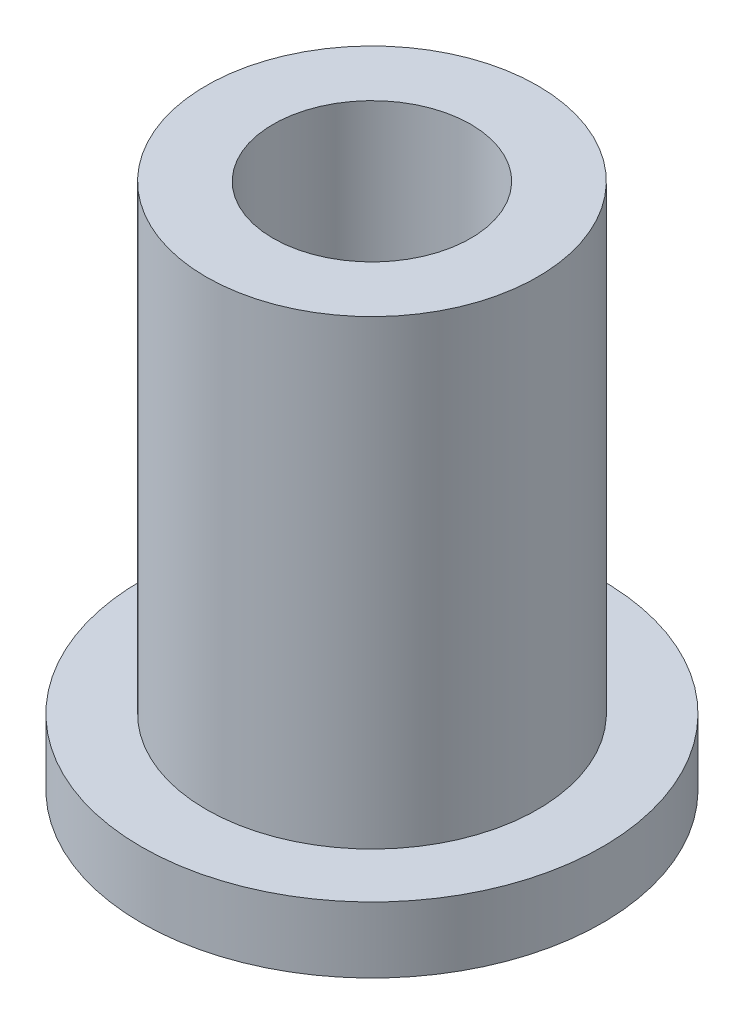
from build123d import *

# Parameters (mm, degrees)
SKETCH1_R           = 5.55625
BOSS_EXTRUDE1_DEPTH = 1.5875
SKETCH2_R           = 3.99415
BOSS_EXTRUDE2_DEPTH = 11.1125
SKETCH3_R           = 2.38125
CUT_EXTRUDE1_DEPTH  = 12.7


with BuildPart() as part:
    # Sketch1 → Boss-Extrude1 (new body)
    with BuildSketch(Plane(origin=(0, 0, 0), x_dir=(1, 0, 0), z_dir=(0, 1, 0))):
        with Locations(Location((0, 0, 0), (0, 0, 270))):
            Circle(SKETCH1_R)
    extrude(amount=BOSS_EXTRUDE1_DEPTH)

    # Sketch2 → Boss-Extrude2 (add)
    with BuildSketch(Plane(origin=(0, 1.5875, 0), x_dir=(1, 0, 0), z_dir=(0, 1, 0))):
        with Locations(Location((0, 0, 0), (0, 0, 270))):
            Circle(SKETCH2_R)
    extrude(amount=BOSS_EXTRUDE2_DEPTH)

    # Sketch3 → Cut-Extrude1 (cut)
    with BuildSketch(Plane(origin=(0, 12.7, 0), x_dir=(1, 0, 0), z_dir=(0, 1, 0))):
        with Locations(Location((0, 0, 0), (0, 0, 270))):
            Circle(SKETCH3_R)
    extrude(amount=-CUT_EXTRUDE1_DEPTH, mode=Mode.SUBTRACT)


solid = part.part
